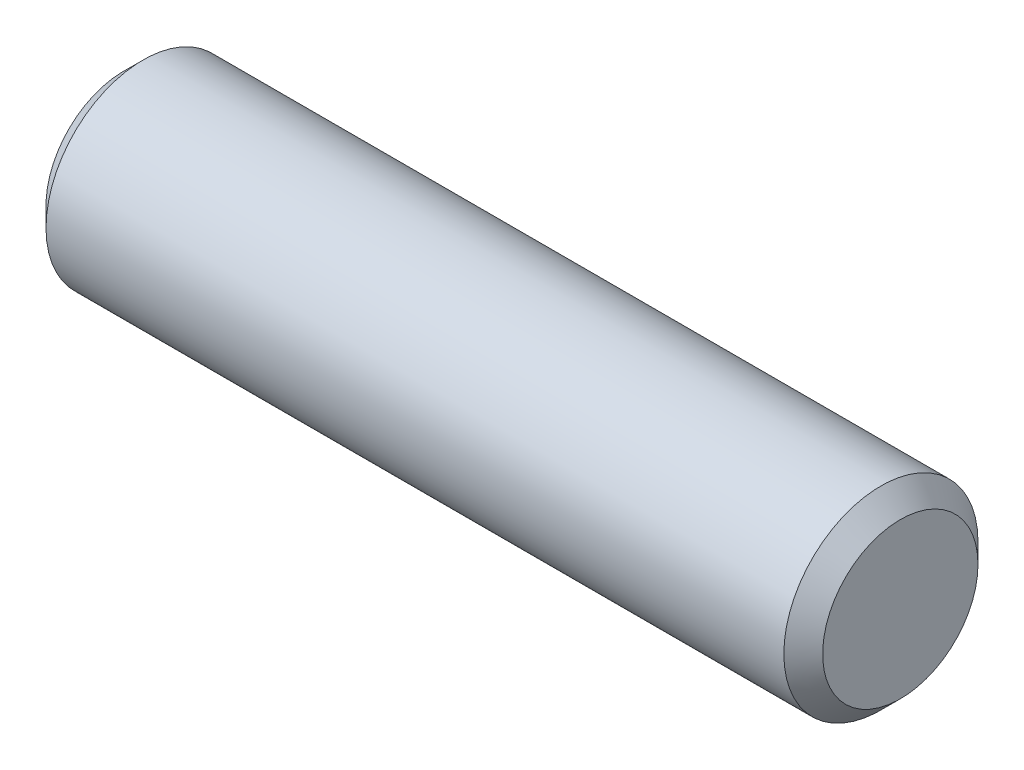
from build123d import *

# Parameters (mm, degrees)
EXTRUDE1_DEPTH      = 6.35
EXTRUDE1_DEPTH_BACK = 6.35
SKETCH2_R           = 1.5875
CHAMFER1_SIZE       = 0.3175


with BuildPart() as part:
    # Sketch2 → Extrude1 (new, two sides: drawn at the far end of the back side and taken through both)
    with BuildSketch(Plane(origin=(0, 0, 0), x_dir=(0, 0, -1), z_dir=(1, 0, 0)).offset(-EXTRUDE1_DEPTH_BACK)):
        Circle(SKETCH2_R)
    extrude(amount=EXTRUDE1_DEPTH + EXTRUDE1_DEPTH_BACK)

    # Chamfer1
    chamfer1_edges = [part.edges().sort_by_distance(p)[0] for p in [
        (-6.35, 0, 1.5875),
        (6.35, 0, 1.5875),
    ]]
    chamfer(chamfer1_edges, length=CHAMFER1_SIZE)


solid = part.part
